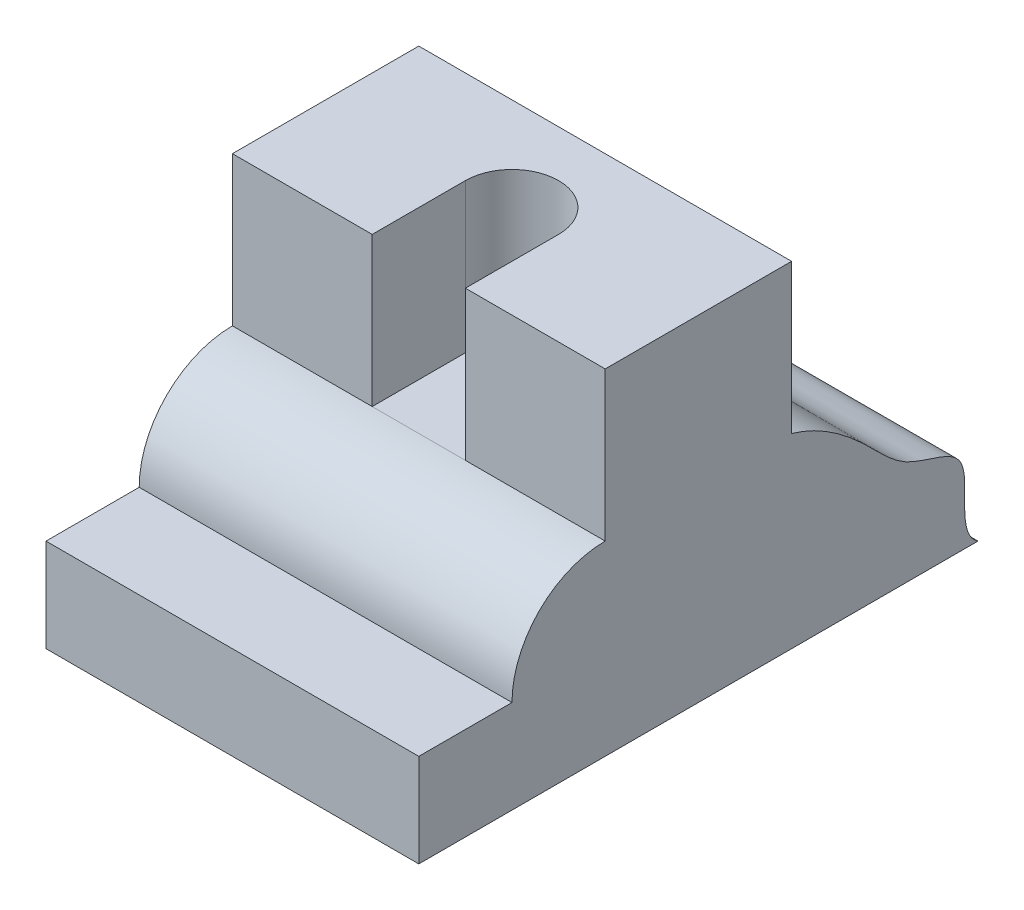
from build123d import *

# Parameters (mm, degrees)
SKETCH_1_W      = 200
SKETCH_1_H      = 100
EXTRUDE_1_DEPTH = 100
EXTRUDE_2_DEPTH = 200
EXTRUDE_3_DEPTH = 200
EXTRUDE_5_DEPTH = 80


with BuildPart() as part:
    # 草图1 → 凸台-拉伸1 (new body)
    with BuildSketch(Plane(origin=(0, 0, 0), x_dir=(1, 0, 0), z_dir=(0, 1, 0))):
        Rectangle(SKETCH_1_W, SKETCH_1_H)
    extrude(amount=EXTRUDE_1_DEPTH)

    # 草图2 → 凸台-拉伸2 (add)
    with BuildSketch(Plane.ZY.offset(100)):
        with BuildLine():
            Line((50, 100), (50, 50))
            Line((50, 50), (50, 0))
            Line((50, 0), (150, 0))
            Line((150, 0), (150, 50))
            Line((150, 50), (100, 50))
            ThreePointArc((100, 50), (85.355339059, 85.355339059), (50, 100))
        make_face()
    extrude(amount=-EXTRUDE_2_DEPTH)

    # 草图3 → 凸台-拉伸3 (add)
    with BuildSketch(Plane.ZY.offset(100)):
        with BuildLine():
            Line((-50, 0), (-150, 0))
            add(Edge.make_bspline(
                [(-50, 100), (-66.721438415, 95.122264267), (-87.621848077, 78.445464682), (-111.42761731, 51.798834324), (-153.788531602, 47.400816106), (-137.140673225, 8.568321879), (-150, 0)],
                knots=[0, 0, 0, 0, 0.338265494, 0.517817437, 0.712666981, 1, 1, 1, 1], degree=3))
            Line((-50, 100), (-50, 0))
        make_face()
    extrude(amount=-EXTRUDE_3_DEPTH)

    # 草图4 → 凸台-拉伸5 (add)
    with BuildSketch(Plane(origin=(0, 100, 0), x_dir=(1, 0, 0), z_dir=(0, 1, 0))):
        with BuildLine():
            Line((100, -50), (25, -50))
            Line((25, -50), (25, 0))
            ThreePointArc((25, 0), (0, 25), (-25, 0))
            Line((-25, 0), (-25, -50))
            Line((-25, -50), (-100, -50))
            Line((-100, -50), (-100, 50))
            Line((-100, 50), (100, 50))
            Line((100, 50), (100, -50))
        make_face()
    extrude(amount=EXTRUDE_5_DEPTH)


solid = part.part
